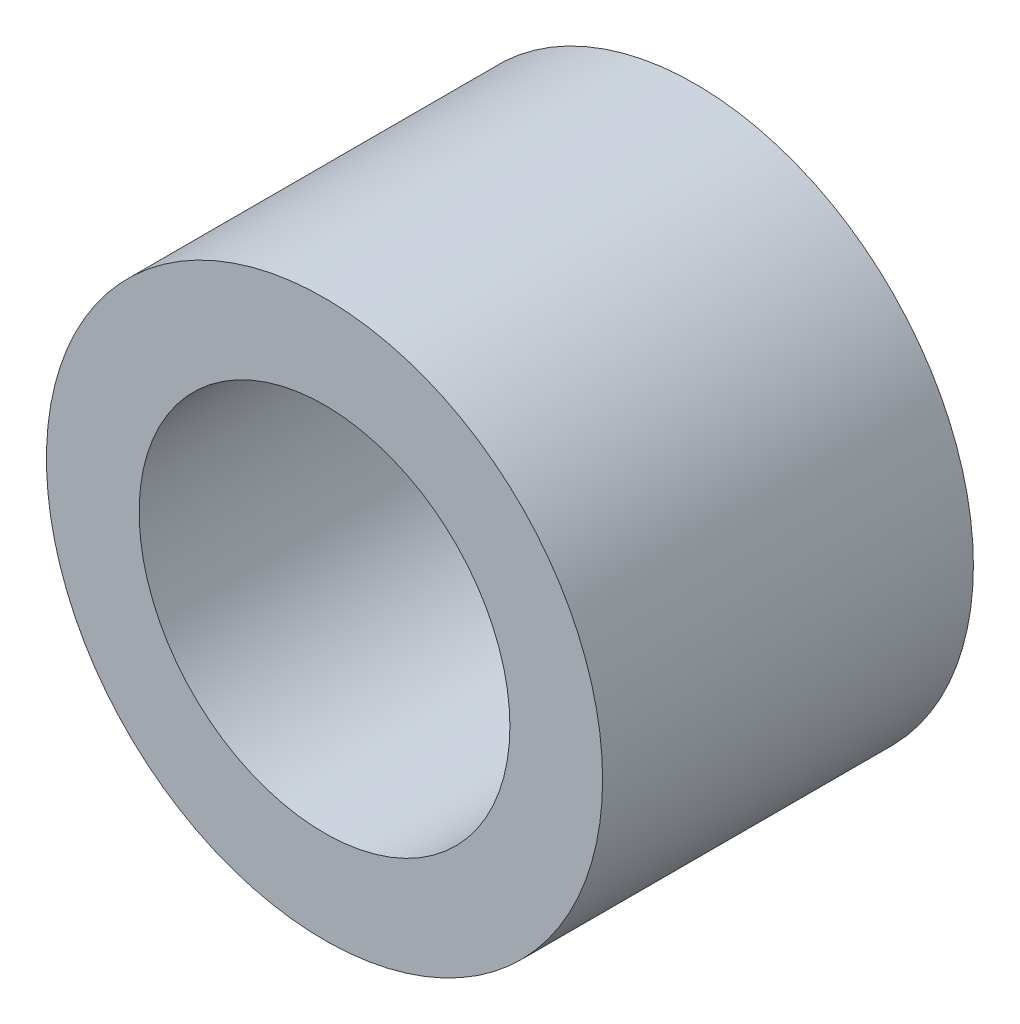
from build123d import *

# Parameters (mm, degrees)
SKETCH_1_R      = 3
SKETCH_1_R_2    = 2
EXTRUDE_1_DEPTH = 2


with BuildPart() as part:
    # 草图1 → 凸台-拉伸1 (new, symmetric)
    with BuildSketch(Plane.XY):
        Circle(SKETCH_1_R)
        Circle(SKETCH_1_R_2, mode=Mode.SUBTRACT)
    extrude(amount=EXTRUDE_1_DEPTH, both=True)


solid = part.part
